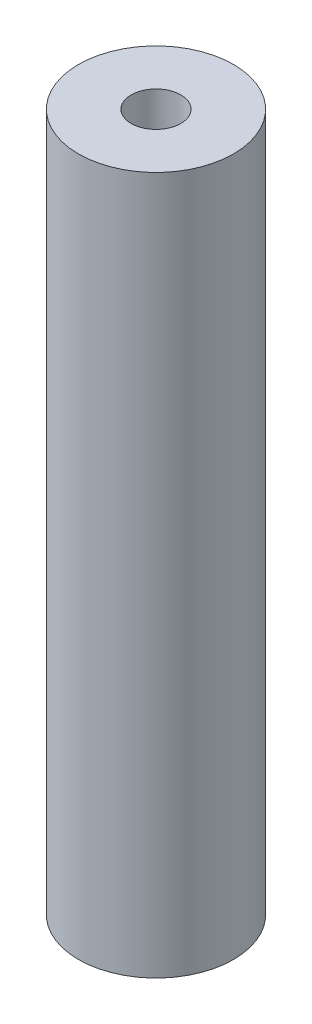
from build123d import *

# Parameters (mm, degrees)
SKETCH1_R           = 5
SKETCH1_R_2         = 1.6
BOSS_EXTRUDE1_DEPTH = 45


with BuildPart() as part:
    # Sketch1 → Boss-Extrude1 (new body)
    with BuildSketch(Plane(origin=(0, 0, 0), x_dir=(1, 0, 0), z_dir=(0, 1, 0))):
        with Locations(Location((0, 0, 0), (0, 0, 90))):
            Circle(SKETCH1_R)
        with Locations(Location((0, 0, 0), (0, 0, 90))):
            Circle(SKETCH1_R_2, mode=Mode.SUBTRACT)
    extrude(amount=BOSS_EXTRUDE1_DEPTH)


solid = part.part
